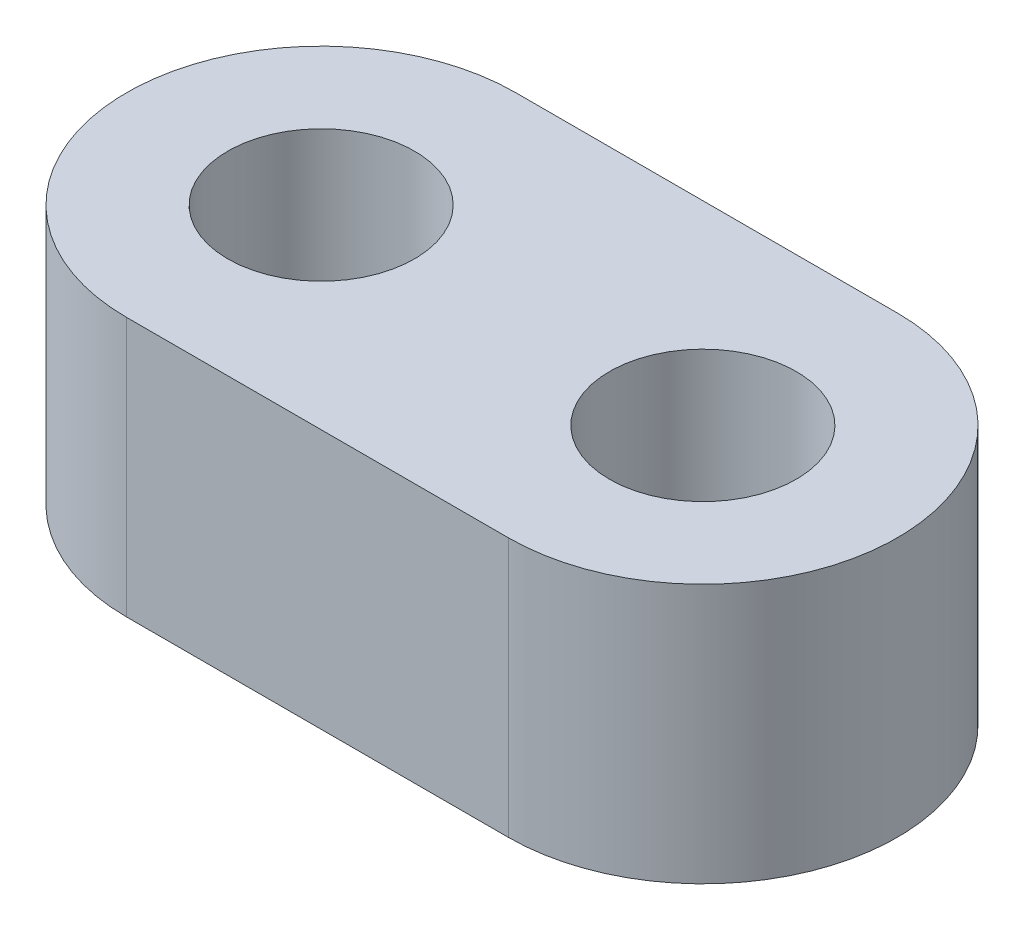
from build123d import *

# Parameters (mm, degrees)
SKETCH2_R           = 2.286
BOSS_EXTRUDE1_DEPTH = 6.35
SKETCH4_R           = 2.286
CUT_EXTRUDE2_DEPTH  = 17.185114529


with BuildPart() as part:
    # Sketch2 → Boss-Extrude1 (new body)
    with BuildSketch(Plane(origin=(0, 0, 0), x_dir=(1, 0, 0), z_dir=(0, 1, 0))):
        with BuildLine():
            Line((0, 4.7625), (14.105106383, 4.7625))
            Line((14.105106383, 4.7625), (14.105106383, -4.7625))
            Line((14.105106383, -4.7625), (0, -4.7625))
            ThreePointArc((0, -4.7625), (-4.7625, 0), (0, 4.7625))
        make_face()
        with Locations(Location((0, 0, 0), (0, 0, 270))):
            Circle(SKETCH2_R, mode=Mode.SUBTRACT)
    extrude(amount=BOSS_EXTRUDE1_DEPTH)

    # Sketch4 → Cut-Extrude2 (cut, through all)
    with BuildSketch(Plane(origin=(0, 6.35, 0), x_dir=(1, 0, 0), z_dir=(0, 1, 0))):
        with BuildLine():
            Line((14.105106383, 4.7625), (9.342606383, 4.7625))
            ThreePointArc((9.342606383, 4.7625), (12.710202422, 3.367596052), (14.105106383, 1.8e-08))
            Line((14.105106383, 1.8e-08), (14.105106383, 4.7625))
        make_face()
        with BuildLine():
            Line((14.105106383, -4.7625), (14.105106383, 1.8e-08))
            ThreePointArc((14.105106383, 1.8e-08), (12.710202435, -3.367596039), (9.342606383, -4.7625))
            Line((9.342606383, -4.7625), (14.105106383, -4.7625))
        make_face()
        with Locations(Location((9.342606383, 0, 0), (0, 0, 270))):
            Circle(SKETCH4_R)
    extrude(amount=-CUT_EXTRUDE2_DEPTH, mode=Mode.SUBTRACT)


solid = part.part
